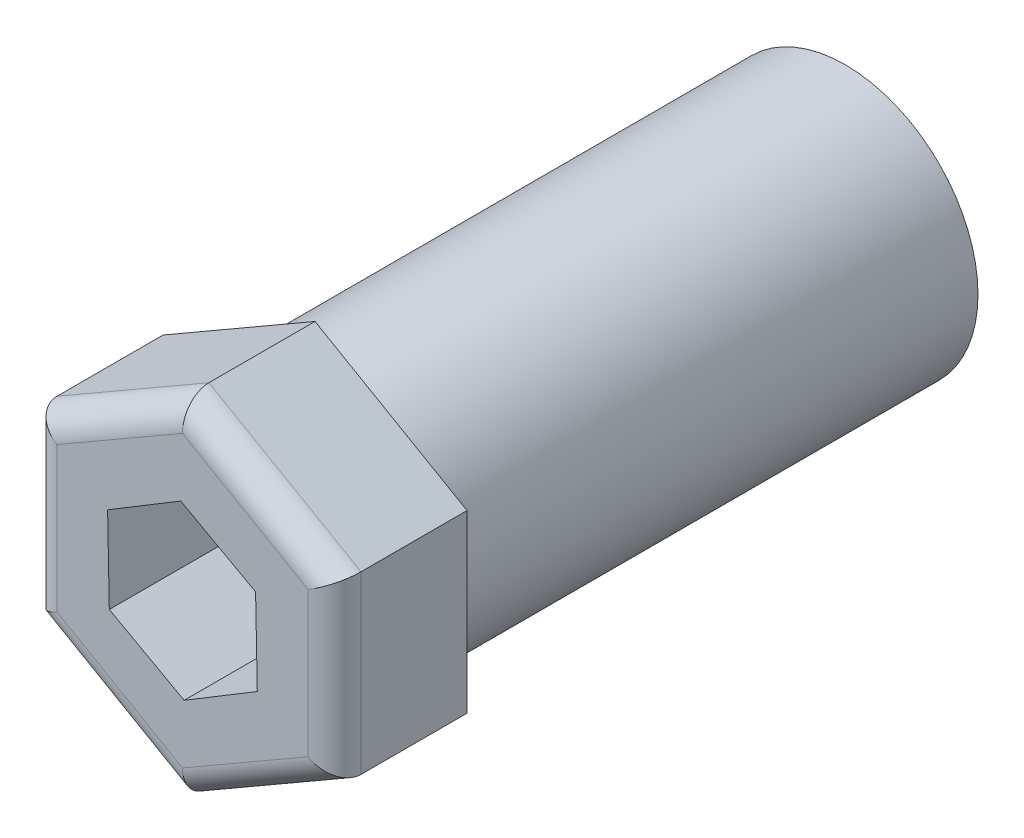
from build123d import *

# Parameters (mm, degrees)
SKETCH1_R           = 1
BOSS_EXTRUDE1_DEPTH = 4
BOSS_EXTRUDE2_DEPTH = 1
CUT_EXTRUDE1_DEPTH  = 1
FILLET1_R           = 0.2


with BuildPart() as part:
    # Sketch1 → Boss-Extrude1 (new body)
    with BuildSketch(Plane.XY):
        Circle(SKETCH1_R)
    extrude(amount=BOSS_EXTRUDE1_DEPTH)

    # Sketch2 → Boss-Extrude2 (add)
    with BuildSketch(Plane.XY.offset(4)):
        Polygon((0, 1.323749562), (-1.146400749, 0.661874781), (-1.146400749, -0.661874781), (0, -1.323749562), (1.146400749, -0.661874781), (1.146400749, 0.661874781), align=None)
    extrude(amount=BOSS_EXTRUDE2_DEPTH)

    # Sketch3 → Cut-Extrude1 (cut)
    with BuildSketch(Plane.XY.offset(5)):
        Polygon((-0.56445286, 0.311116839), (-0.551661517, -0.333272096), (0.012791344, -0.644388936), (0.56445286, -0.311116839), (0.551661517, 0.333272096), (-0.012791344, 0.644388936), align=None)
    extrude(amount=-CUT_EXTRUDE1_DEPTH, mode=Mode.SUBTRACT)

    # Fillet1
    fillet1_edges = [part.edges().sort_by_distance(p)[0] for p in [
        (0.573200374, 0.992812171, 5),
        (-0.573200374, 0.992812171, 5),
        (-1.146400749, 0, 5),
        (-0.573200374, -0.992812171, 5),
        (0.573200374, -0.992812171, 5),
        (1.146400749, 0, 5),
    ]]
    fillet(fillet1_edges, radius=FILLET1_R)


solid = part.part
